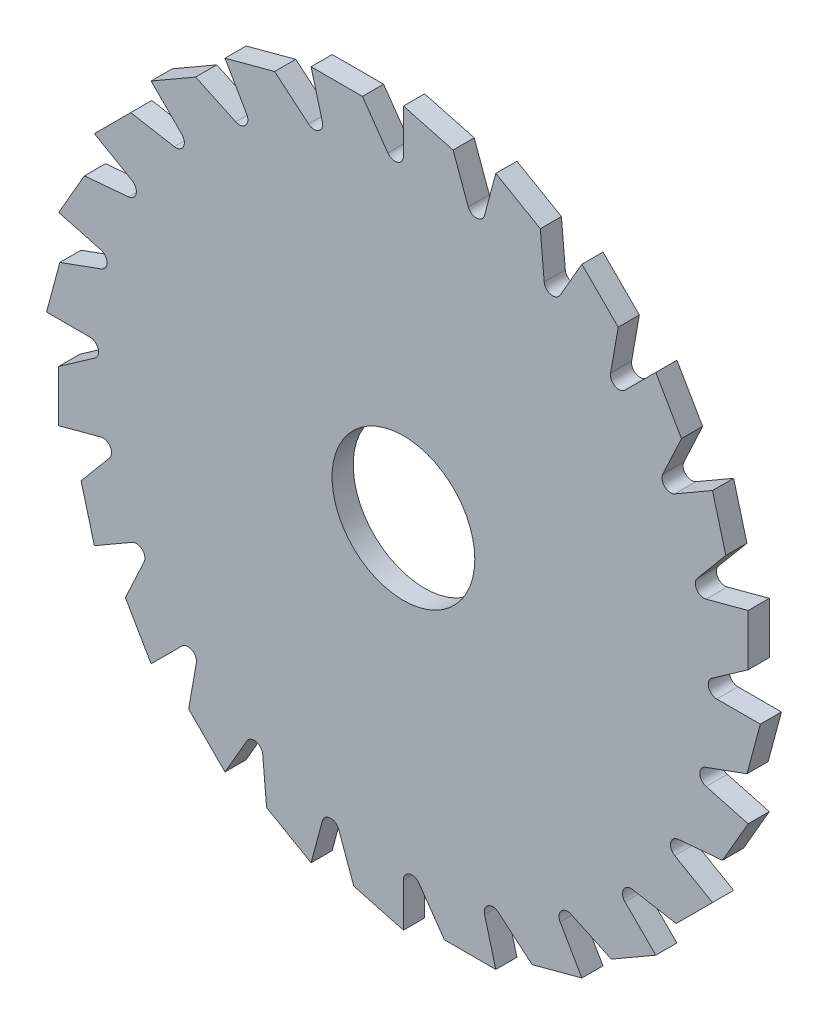
from build123d import *

# Parameters (mm, degrees)
SKETCH1_R           = 6.35
BOSS_EXTRUDE1_DEPTH = 1.8796


with BuildPart() as part:
    # Sketch1 → Boss-Extrude1 (new body)
    with BuildSketch(Plane.XY):
        with BuildLine():
            Line((0, 31.75), (4.416212878, 30.566679326))
            Line((4.416212878, 30.566679326), (5.763426192, 26.865241165))
            ThreePointArc((5.763426192, 26.865241165), (6.512709942, 26.364585769), (7.215507449, 26.928640402))
            Line((7.215507449, 26.928640402), (8.217504682, 30.668144985))
            Line((8.217504682, 30.668144985), (12.176972828, 28.382144985))
            Line((12.176972828, 28.382144985), (12.520278272, 24.458145807))
            ThreePointArc((12.520278272, 24.458145807), (13.114451646, 23.780620926), (13.939289989, 24.143558483))
            Line((13.939289989, 24.143558483), (15.875, 27.49630657))
            Line((15.875, 27.49630657), (19.107892204, 24.263414367))
            Line((19.107892204, 24.263414367), (18.423894078, 20.384268232))
            ThreePointArc((18.423894078, 20.384268232), (18.822465142, 19.576046065), (19.713132953, 19.713132953))
            Line((19.713132953, 19.713132953), (22.450640303, 22.450640303))
            Line((22.450640303, 22.450640303), (24.736640303, 18.491172157))
            Line((24.736640303, 18.491172157), (23.071951949, 14.921236463))
            ThreePointArc((23.071951949, 14.921236463), (23.247758745, 14.037396016), (24.143558483, 13.939289989))
            Line((24.143558483, 13.939289989), (27.49630657, 15.875))
            Line((27.49630657, 15.875), (28.679627244, 11.458787122))
            Line((28.679627244, 11.458787122), (26.147694424, 8.441347087))
            ThreePointArc((26.147694424, 8.441347087), (26.088756008, 7.542120627), (26.928640402, 7.215507449))
            Line((26.928640402, 7.215507449), (30.668144985, 8.217504682))
            Line((30.668144985, 8.217504682), (30.668144985, 3.645504682))
            Line((30.668144985, 3.645504682), (27.441514734, 1.386193858))
            ThreePointArc((27.441514734, 1.386193858), (27.151847662, 0.532862181), (27.878579979, 0))
            Line((27.878579979, 0), (31.75, 0))
            Line((31.75, 0), (30.566679326, -4.416212878))
            Line((30.566679326, -4.416212878), (26.865241165, -5.763426192))
            ThreePointArc((26.865241165, -5.763426192), (26.364585769, -6.512709942), (26.928640402, -7.215507449))
            Line((26.928640402, -7.215507449), (30.668144985, -8.217504682))
            Line((30.668144985, -8.217504682), (28.382144985, -12.176972828))
            Line((28.382144985, -12.176972828), (24.458145807, -12.520278272))
            ThreePointArc((24.458145807, -12.520278272), (23.780620926, -13.114451646), (24.143558483, -13.939289989))
            Line((24.143558483, -13.939289989), (27.49630657, -15.875))
            Line((27.49630657, -15.875), (24.263414367, -19.107892204))
            Line((24.263414367, -19.107892204), (20.384268232, -18.423894078))
            ThreePointArc((20.384268232, -18.423894078), (19.576046065, -18.822465142), (19.713132953, -19.713132953))
            Line((19.713132953, -19.713132953), (22.450640303, -22.450640303))
            Line((22.450640303, -22.450640303), (18.491172157, -24.736640303))
            Line((18.491172157, -24.736640303), (14.921236463, -23.071951949))
            ThreePointArc((14.921236463, -23.071951949), (14.037396016, -23.247758745), (13.939289989, -24.143558483))
            Line((13.939289989, -24.143558483), (15.875, -27.49630657))
            Line((15.875, -27.49630657), (11.458787122, -28.679627244))
            Line((11.458787122, -28.679627244), (8.441347087, -26.147694424))
            ThreePointArc((8.441347087, -26.147694424), (7.542120627, -26.088756008), (7.215507449, -26.928640402))
            Line((7.215507449, -26.928640402), (8.217504682, -30.668144985))
            Line((8.217504682, -30.668144985), (3.645504682, -30.668144985))
            Line((3.645504682, -30.668144985), (1.386193858, -27.441514734))
            ThreePointArc((1.386193858, -27.441514734), (0.532862181, -27.151847662), (0, -27.878579979))
            Line((0, -27.878579979), (0, -31.75))
            Line((0, -31.75), (-4.416212878, -30.566679326))
            Line((-4.416212878, -30.566679326), (-5.763426192, -26.865241165))
            ThreePointArc((-5.763426192, -26.865241165), (-6.512709942, -26.364585769), (-7.215507449, -26.928640402))
            Line((-7.215507449, -26.928640402), (-8.217504682, -30.668144985))
            Line((-8.217504682, -30.668144985), (-12.176972828, -28.382144985))
            Line((-12.176972828, -28.382144985), (-12.520278272, -24.458145807))
            ThreePointArc((-12.520278272, -24.458145807), (-13.114451646, -23.780620926), (-13.939289989, -24.143558483))
            Line((-13.939289989, -24.143558483), (-15.875, -27.49630657))
            Line((-15.875, -27.49630657), (-19.107892204, -24.263414367))
            Line((-19.107892204, -24.263414367), (-18.423894078, -20.384268232))
            ThreePointArc((-18.423894078, -20.384268232), (-18.822465142, -19.576046065), (-19.713132953, -19.713132953))
            Line((-19.713132953, -19.713132953), (-22.450640303, -22.450640303))
            Line((-22.450640303, -22.450640303), (-24.736640303, -18.491172157))
            Line((-24.736640303, -18.491172157), (-23.071951949, -14.921236463))
            ThreePointArc((-23.071951949, -14.921236463), (-23.247758745, -14.037396016), (-24.143558483, -13.939289989))
            Line((-24.143558483, -13.939289989), (-27.49630657, -15.875))
            Line((-27.49630657, -15.875), (-28.679627244, -11.458787122))
            Line((-28.679627244, -11.458787122), (-26.147694424, -8.441347087))
            ThreePointArc((-26.147694424, -8.441347087), (-26.088756008, -7.542120627), (-26.928640402, -7.215507449))
            Line((-26.928640402, -7.215507449), (-30.668144985, -8.217504682))
            Line((-30.668144985, -8.217504682), (-30.668144985, -3.645504682))
            Line((-30.668144985, -3.645504682), (-27.441514734, -1.386193858))
            ThreePointArc((-27.441514734, -1.386193858), (-27.151847662, -0.532862181), (-27.878579979, 0))
            Line((-27.878579979, 0), (-31.75, 0))
            Line((-31.75, 0), (-30.566679326, 4.416212878))
            Line((-30.566679326, 4.416212878), (-26.865241165, 5.763426192))
            ThreePointArc((-26.865241165, 5.763426192), (-26.364585769, 6.512709942), (-26.928640402, 7.215507449))
            Line((-26.928640402, 7.215507449), (-30.668144985, 8.217504682))
            Line((-30.668144985, 8.217504682), (-28.382144985, 12.176972828))
            Line((-28.382144985, 12.176972828), (-24.458145807, 12.520278272))
            ThreePointArc((-24.458145807, 12.520278272), (-23.780620926, 13.114451646), (-24.143558483, 13.939289989))
            Line((-24.143558483, 13.939289989), (-27.49630657, 15.875))
            Line((-27.49630657, 15.875), (-24.263414367, 19.107892204))
            Line((-24.263414367, 19.107892204), (-20.384268232, 18.423894078))
            ThreePointArc((-20.384268232, 18.423894078), (-19.576046065, 18.822465142), (-19.713132953, 19.713132953))
            Line((-19.713132953, 19.713132953), (-22.450640303, 22.450640303))
            Line((-22.450640303, 22.450640303), (-18.491172157, 24.736640303))
            Line((-18.491172157, 24.736640303), (-14.921236463, 23.071951949))
            ThreePointArc((-14.921236463, 23.071951949), (-14.037396016, 23.247758745), (-13.939289989, 24.143558483))
            Line((-13.939289989, 24.143558483), (-15.875, 27.49630657))
            Line((-15.875, 27.49630657), (-11.458787122, 28.679627244))
            Line((-11.458787122, 28.679627244), (-8.441347087, 26.147694424))
            ThreePointArc((-8.441347087, 26.147694424), (-7.542120627, 26.088756008), (-7.215507449, 26.928640402))
            Line((-7.215507449, 26.928640402), (-8.217504682, 30.668144985))
            Line((-8.217504682, 30.668144985), (-3.645504682, 30.668144985))
            Line((-3.645504682, 30.668144985), (-1.386193858, 27.441514734))
            ThreePointArc((-1.386193858, 27.441514734), (-0.532862181, 27.151847662), (0, 27.878579979))
            Line((0, 27.878579979), (0, 31.75))
        make_face()
        Circle(SKETCH1_R, mode=Mode.SUBTRACT)
    extrude(amount=BOSS_EXTRUDE1_DEPTH)


solid = part.part
